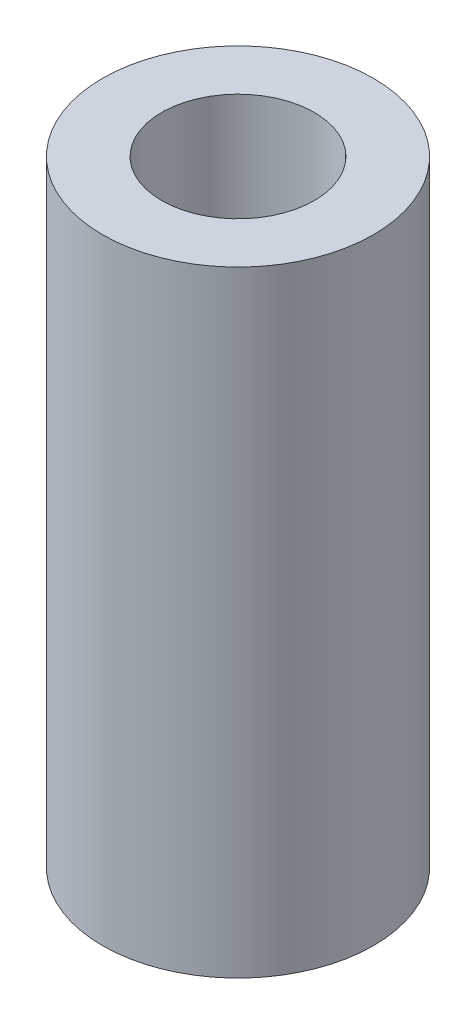
from build123d import *

# Parameters (mm, degrees)
SKETCH1_R           = 2.75
SKETCH1_R_2         = 1.55
BOSS_EXTRUDE1_DEPTH = 12.5


with BuildPart() as part:
    # Sketch1 → Boss-Extrude1 (new body)
    with BuildSketch(Plane(origin=(0, 0, 0), x_dir=(1, 0, 0), z_dir=(0, 1, 0))):
        with Locations(Location((0, 0, 0), (0, 0, 270))):
            Circle(SKETCH1_R)
        with Locations(Location((0, 0, 0), (0, 0, 270))):
            Circle(SKETCH1_R_2, mode=Mode.SUBTRACT)
    extrude(amount=BOSS_EXTRUDE1_DEPTH)


solid = part.part
